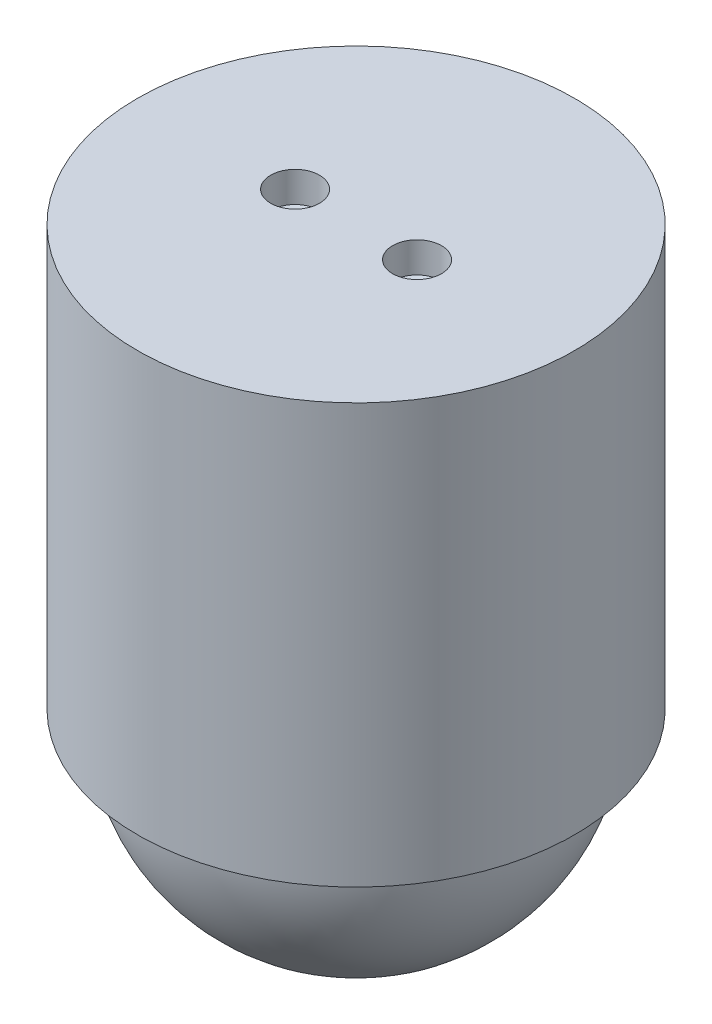
from build123d import *

# Parameters (mm, degrees)
F_2_CLEARANCE_HOLE1_D     = 2.4384
F_2_CLEARANCE_HOLE1_DEPTH = 1.524
F_2_CLEARANCE_HOLE1_TIP   = 0.732569267


with BuildPart() as part:
    # Sketch1 → Revolve1 (revolve)
    with BuildSketch(Plane.XY):
        with BuildLine():
            Line((0, 0), (-10.922, 0))
            Line((-10.922, 0), (-10.922, -20.955))
            Line((-10.922, -20.955), (-9.525, -20.955))
            ThreePointArc((-9.525, -20.955), (-6.735192091, -27.690192091), (0, -30.48))
            Line((0, -30.48), (0, 0))
        make_face()
    revolve(axis=Axis((0, 0, 0), (0, -1, 0)))

    # #2 Clearance Hole1
    with Locations(Plane(origin=(0, 0, 0), x_dir=(1, 0, 0), z_dir=(0, 1, 0))):
        with Locations((3.048, 0), (-3.048, 0)):
            Hole(F_2_CLEARANCE_HOLE1_D / 2, depth=F_2_CLEARANCE_HOLE1_DEPTH)
            with Locations((0, 0, -(F_2_CLEARANCE_HOLE1_DEPTH + F_2_CLEARANCE_HOLE1_TIP / 2))):  # 118° drill point
                Cone(0, F_2_CLEARANCE_HOLE1_D / 2, F_2_CLEARANCE_HOLE1_TIP, mode=Mode.SUBTRACT)


solid = part.part
